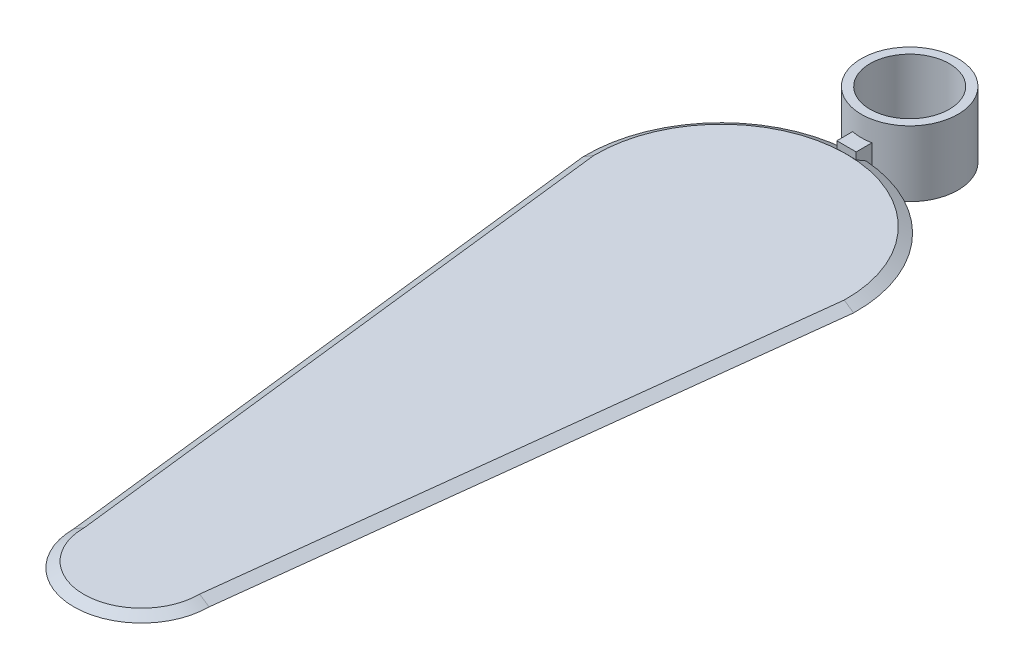
from build123d import *

# Parameters (mm, degrees)
SALIENTE_EXTRUIR1_DEPTH      = 0.3
SALIENTE_EXTRUIR1_TAPER      = 60
CROQUIS3_W                   = 1
CROQUIS3_H                   = 1
SALIENTE_EXTRUIR2_DEPTH      = 0.3
CROQUIS4_W                   = 1
CROQUIS4_H                   = 1
SALIENTE_EXTRUIR3_DEPTH      = 0.519615
SALIENTE_EXTRUIR4_DEPTH      = 1.7
SALIENTE_EXTRUIR4_DEPTH_BACK = 1.7
CROQUIS5_R                   = 2.5
CROQUIS7_R                   = 2.05
CORTAR_EXTRUIR1_DEPTH        = 43.960206994


with BuildPart() as part:
    # Croquis1 → Saliente-Extruir1 (new body)
    with BuildSketch(Plane(origin=(0, 0, 0), x_dir=(1, 0, 0), z_dir=(0, 1, 0))):
        with BuildLine():
            ThreePointArc((-3.5, 0), (0, -3.5), (3.5, 0))
            Line((3.5, 0), (6.998354756, 29.848241299))
            ThreePointArc((6.998354756, 29.848241299), (0, 37), (-6.998354756, 29.848241299))
            Line((-6.998354756, 29.848241299), (-3.5, 0))
        make_face()
    extrude(amount=SALIENTE_EXTRUIR1_DEPTH, taper=SALIENTE_EXTRUIR1_TAPER)



with BuildPart() as body_2:
    # Croquis3 → Saliente-Extruir2 (new body)
    with BuildSketch(Plane.XY.offset(-37)):
        with Locations((0, 0.15)):
            Rectangle(CROQUIS3_W, CROQUIS3_H)
    extrude(amount=-SALIENTE_EXTRUIR2_DEPTH)


with BuildPart() as part_1:
    add(part.part)

    add(body_2.part)  # Saliente-Extruir3 merges body 2
    # Croquis4 → Saliente-Extruir3 (add)
    with BuildSketch(Plane.XY.offset(-37)):
        with Locations((0, 0.15)):
            Rectangle(CROQUIS4_W, CROQUIS4_H)
    extrude(amount=SALIENTE_EXTRUIR3_DEPTH)

    # Croquis5 → Saliente-Extruir4 (add, two sides: drawn at the far end of the back side and taken through both)
    with BuildSketch(Plane(origin=(0, 0, 0), x_dir=(1, 0, 0), z_dir=(0, 1, 0)).offset(-SALIENTE_EXTRUIR4_DEPTH_BACK)):
        with Locations(Location((0, 39.749489743, 0), (0, 0, 270))):
            Circle(CROQUIS5_R)
    extrude(amount=SALIENTE_EXTRUIR4_DEPTH + SALIENTE_EXTRUIR4_DEPTH_BACK)

    # Croquis7 → Cortar-Extruir1 (cut, through all)
    with BuildSketch(Plane(origin=(0, 1.7, 0), x_dir=(1, 0, 0), z_dir=(0, 1, 0))):
        with Locations(Location((0, 39.749489743, 0), (0, 0, 270))):
            Circle(CROQUIS7_R)
    extrude(amount=-CORTAR_EXTRUIR1_DEPTH, mode=Mode.SUBTRACT)


solid = part_1.part
